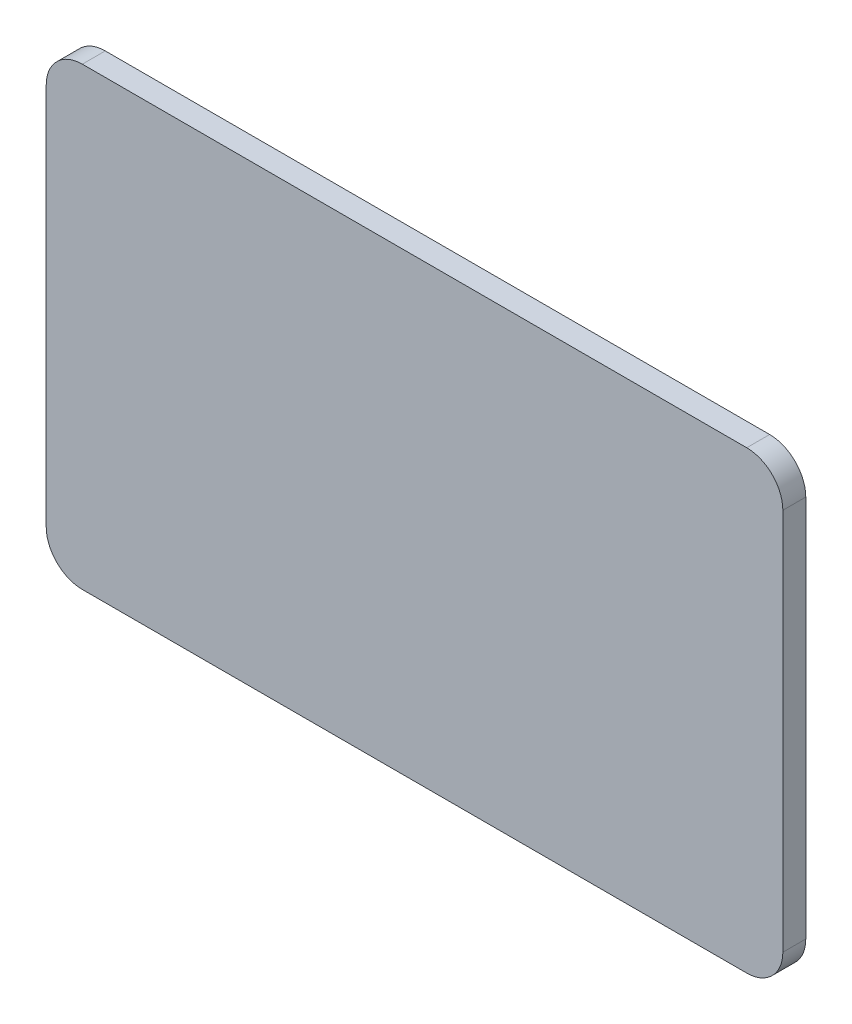
from build123d import *

# Parameters (mm, degrees)
SKETCH1_W           = 102
SKETCH1_H           = 63
BOSS_EXTRUDE1_DEPTH = 3.175
FILLET1_R           = 5


with BuildPart() as part:
    # Sketch1 → Boss-Extrude1 (new body)
    with BuildSketch(Plane.XY):
        Rectangle(SKETCH1_W, SKETCH1_H)
    extrude(amount=BOSS_EXTRUDE1_DEPTH)

    # Fillet1
    fillet1_edges = [part.edges().sort_by_distance(p)[0] for p in [
        (51, -31.5, 1.5875),
        (-51, -31.5, 1.5875),
        (-51, 31.5, 1.5875),
        (51, 31.5, 1.5875),
    ]]
    fillet(fillet1_edges, radius=FILLET1_R)


solid = part.part
